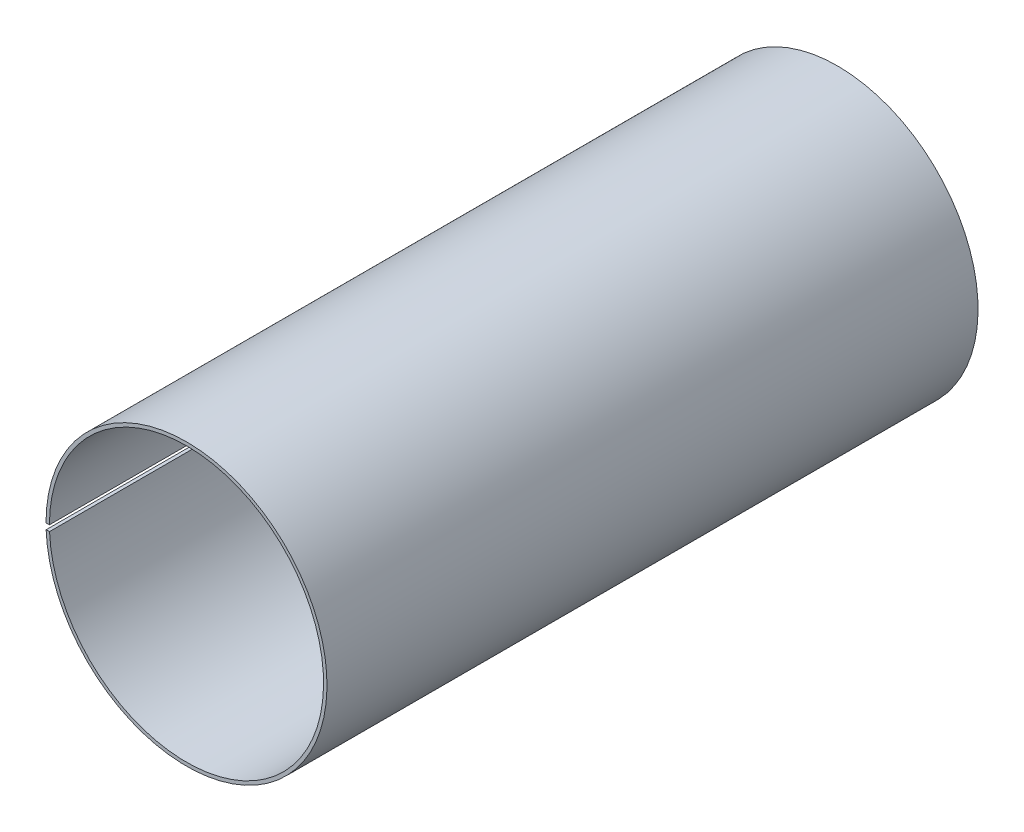
from build123d import *

# Parameters (mm, degrees)
BOSS_EXTRUDE1_DEPTH = 1900


with BuildPart() as part:
    # Sketch1 → Boss-Extrude1 (new body)
    with BuildSketch(Plane.XY):
        with BuildLine():
            Line((-410, 0), (-400, 0))
            ThreePointArc((-400, 0), (399.912310203, 8.375210313), (-399.649279261, -16.746748524))
            Line((-399.649279261, -16.746748524), (-409.640511243, -17.165417237))
            ThreePointArc((-409.640511243, -17.165417237), (409.910117958, 8.584590571), (-410, 0))
        make_face()
    extrude(amount=BOSS_EXTRUDE1_DEPTH)


solid = part.part
